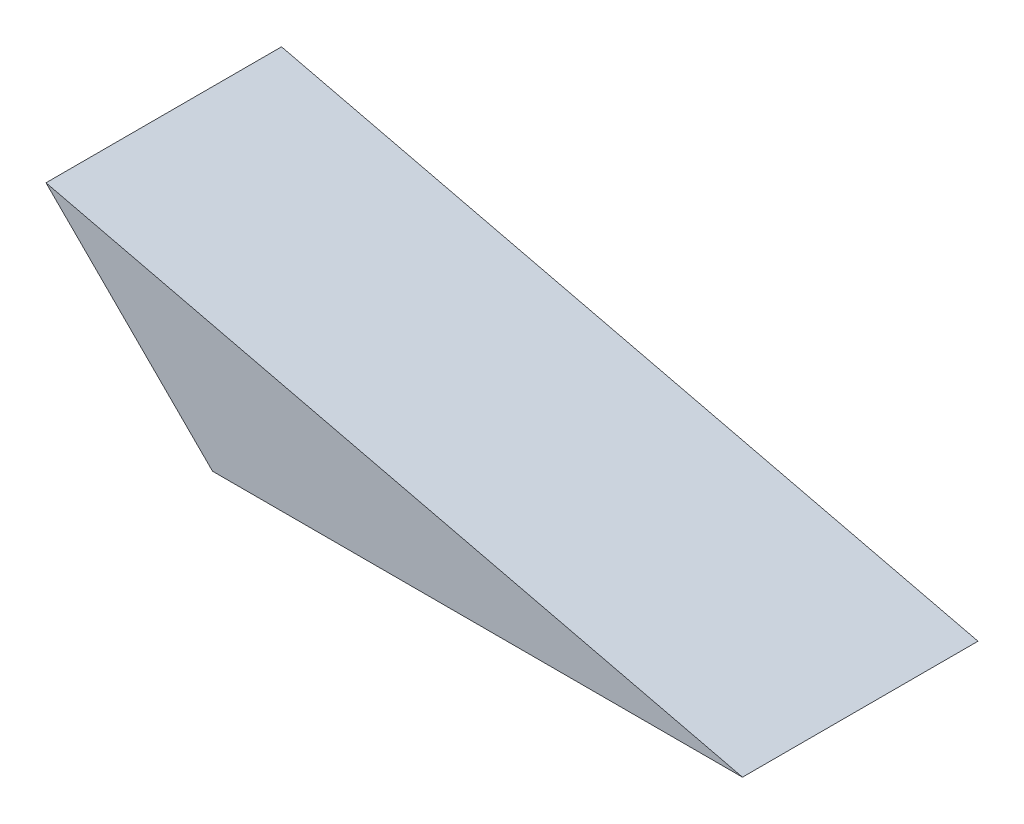
from build123d import *

# Parameters (mm, degrees)
BOSS_EXTRUDE1_DEPTH = 4


with BuildPart() as part:
    # Sketch1 → Boss-Extrude1 (new body)
    with BuildSketch(Plane.XY):
        Polygon((0, 0), (9, 0), (-2.828427125, 2.828427125), align=None)
    extrude(amount=BOSS_EXTRUDE1_DEPTH)


solid = part.part
